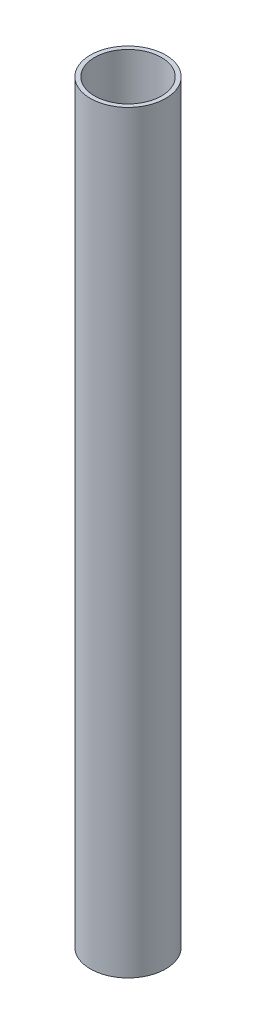
from build123d import *

# Parameters (mm, degrees)
SKETCH1_R           = 7.9375
SKETCH1_R_2         = 7.0485
BOSS_EXTRUDE1_DEPTH = 159


with BuildPart() as part:
    # Sketch1 → Boss-Extrude1 (new body)
    with BuildSketch(Plane(origin=(0, 0, 0), x_dir=(1, 0, 0), z_dir=(0, 1, 0))):
        with Locations(Location((0, 0, 0), (0, 0, 90))):
            Circle(SKETCH1_R)
        with Locations(Location((0, 0, 0), (0, 0, 90))):
            Circle(SKETCH1_R_2, mode=Mode.SUBTRACT)
    extrude(amount=BOSS_EXTRUDE1_DEPTH)


solid = part.part
